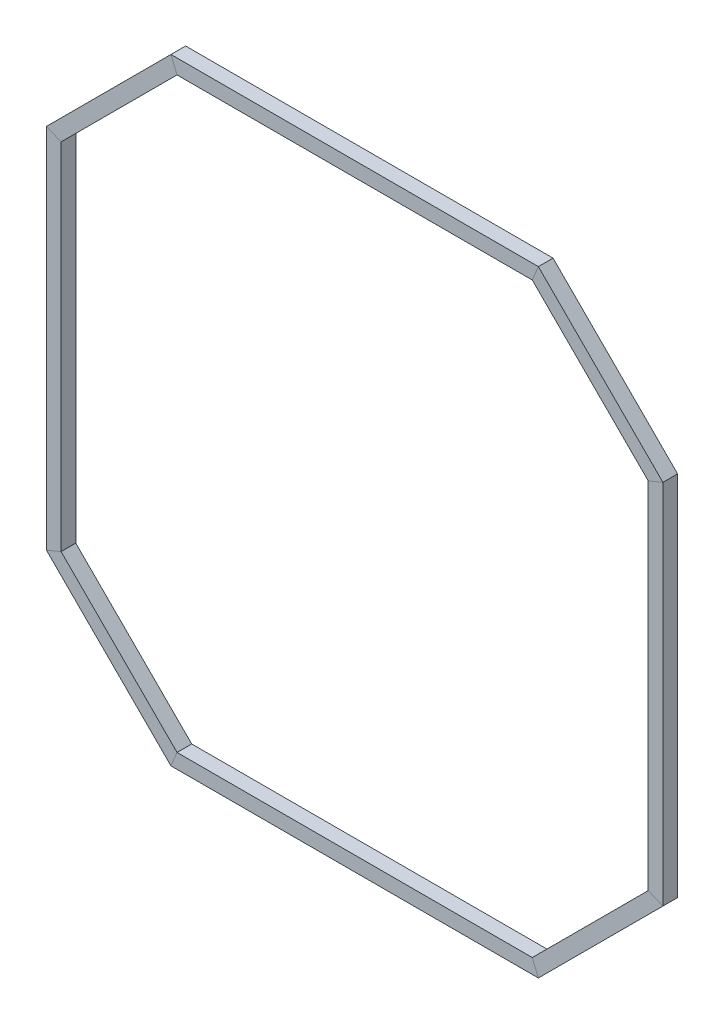
from build123d import *

# Parameters (mm, degrees)
MEMBER_1_DEPTH            = 257.152236891
MEMBER_1_DEPTH_BACK       = 6.857864376
SKETCH11_W                = 10
SKETCH11_H                = 10
SKETCH11_W_2              = 8
SKETCH11_H_2              = 8
SKETCH11_ON_SEGMENT_2_W   = 10
SKETCH11_ON_SEGMENT_2_H   = 10
SKETCH11_ON_SEGMENT_2_W_2 = 8
SKETCH11_ON_SEGMENT_2_H_2 = 8
MEMBER_1_2_DEPTH          = 133.715728753
SKETCH11_ON_SEGMENT_3_W   = 10
SKETCH11_ON_SEGMENT_3_H   = 10
SKETCH11_ON_SEGMENT_3_W_2 = 8
SKETCH11_ON_SEGMENT_3_H_2 = 8
MEMBER_1_3_DEPTH          = 263.715728753
SKETCH11_ON_SEGMENT_4_W   = 10
SKETCH11_ON_SEGMENT_4_H   = 10
SKETCH11_ON_SEGMENT_4_W_2 = 8
SKETCH11_ON_SEGMENT_4_H_2 = 8
MEMBER_1_4_DEPTH          = 133.715728753
SKETCH11_ON_SEGMENT_5_W   = 10
SKETCH11_ON_SEGMENT_5_H   = 10
SKETCH11_ON_SEGMENT_5_W_2 = 8
SKETCH11_ON_SEGMENT_5_H_2 = 8
MEMBER_1_5_DEPTH          = 264.010101268
SKETCH11_ON_SEGMENT_6_W   = 10
SKETCH11_ON_SEGMENT_6_H   = 10
SKETCH11_ON_SEGMENT_6_W_2 = 8
SKETCH11_ON_SEGMENT_6_H_2 = 8
MEMBER_1_6_DEPTH          = 133.715728753
SKETCH11_ON_SEGMENT_7_W   = 10
SKETCH11_ON_SEGMENT_7_H   = 10
SKETCH11_ON_SEGMENT_7_W_2 = 8
SKETCH11_ON_SEGMENT_7_H_2 = 8
MEMBER_1_7_DEPTH          = 263.715728753
SKETCH11_ON_SEGMENT_8_W   = 10
SKETCH11_ON_SEGMENT_8_H   = 10
SKETCH11_ON_SEGMENT_8_W_2 = 8
SKETCH11_ON_SEGMENT_8_H_2 = 8
MEMBER_1_8_DEPTH          = 133.715728753


with BuildPart() as part:
    # Sketch11 → Member 1 (new, two sides: drawn at the far end of the back side and taken through both)
    with BuildSketch(Plane(origin=(-125.147186258, -204.852813742, -5), x_dir=(0, 1, 0), z_dir=(1, 0, 0)).offset(-MEMBER_1_DEPTH_BACK)):
        Rectangle(SKETCH11_W, SKETCH11_H)
        Rectangle(SKETCH11_W_2, SKETCH11_H_2, mode=Mode.SUBTRACT)
    extrude(amount=MEMBER_1_DEPTH + MEMBER_1_DEPTH_BACK)

    # Member 1 mitre 1
    split(bisect_by=Plane(origin=(-125.147186258, -209.852813742, 0), x_dir=(0.382683432, 0.923879533, 0), z_dir=(0.923879533, -0.382683432, 0)), keep=Keep.TOP)

    # Member 1 mitre 2
    split(bisect_by=Plane(origin=(125.147186258, -209.852813742, 0), x_dir=(0.382683432, -0.923879533, 0), z_dir=(-0.923879533, -0.382683432, 0)), keep=Keep.TOP)


with BuildPart() as body_2:
    # Sketch11 on segment 2 (carried to segment 2) → Member 1 2 (new body)
    with BuildSketch(Plane(origin=(116.762409947, -211.166522241, -5), x_dir=(-0.707106781, 0.707106781, 0), z_dir=(0.707106781, 0.707106781, 0))):
        Rectangle(SKETCH11_ON_SEGMENT_2_W, SKETCH11_ON_SEGMENT_2_H)
        Rectangle(SKETCH11_ON_SEGMENT_2_W_2, SKETCH11_ON_SEGMENT_2_H_2, mode=Mode.SUBTRACT)
    extrude(amount=MEMBER_1_2_DEPTH)

    # Member 1 2 mitre 1
    split(bisect_by=Plane(origin=(125.147186258, -209.852813742, 0), x_dir=(-0.382683432, 0.923879533, 0), z_dir=(0.923879533, 0.382683432, 0)), keep=Keep.TOP)

    # Member 1 2 mitre 2
    split(bisect_by=Plane(origin=(210, -125, 0), x_dir=(0.923879533, -0.382683432, 0), z_dir=(-0.382683432, -0.923879533, 0)), keep=Keep.TOP)


with BuildPart() as body_3:
    # Sketch11 on segment 3 (carried to segment 3) → Member 1 3 (new body)
    with BuildSketch(Plane(origin=(205, -131.857864376, -5), x_dir=(-1, 0, 0), z_dir=(0, 1, 0))):
        Rectangle(SKETCH11_ON_SEGMENT_3_W, SKETCH11_ON_SEGMENT_3_H)
        Rectangle(SKETCH11_ON_SEGMENT_3_W_2, SKETCH11_ON_SEGMENT_3_H_2, mode=Mode.SUBTRACT)
    extrude(amount=MEMBER_1_3_DEPTH)

    # Member 1 3 mitre 1
    split(bisect_by=Plane(origin=(210, -125, 0), x_dir=(-0.923879533, 0.382683432, 0), z_dir=(0.382683432, 0.923879533, 0)), keep=Keep.TOP)

    # Member 1 3 mitre 2
    split(bisect_by=Plane(origin=(210, 125, 0), x_dir=(0.923879533, 0.382683432, 0), z_dir=(0.382683432, -0.923879533, 0)), keep=Keep.TOP)


with BuildPart() as body_4:
    # Sketch11 on segment 4 (carried to segment 4) → Member 1 4 (new body)
    with BuildSketch(Plane(origin=(211.313708499, 116.615223689, -5), x_dir=(-0.707106781, -0.707106781, 0), z_dir=(-0.707106781, 0.707106781, 0))):
        Rectangle(SKETCH11_ON_SEGMENT_4_W, SKETCH11_ON_SEGMENT_4_H)
        Rectangle(SKETCH11_ON_SEGMENT_4_W_2, SKETCH11_ON_SEGMENT_4_H_2, mode=Mode.SUBTRACT)
    extrude(amount=MEMBER_1_4_DEPTH)

    # Member 1 4 mitre 1
    split(bisect_by=Plane(origin=(210, 125, 0), x_dir=(-0.923879533, -0.382683432, 0), z_dir=(-0.382683432, 0.923879533, 0)), keep=Keep.TOP)

    # Member 1 4 mitre 2
    split(bisect_by=Plane(origin=(125.147186258, 209.852813742, 0), x_dir=(0.382683432, 0.923879533, 0), z_dir=(0.923879533, -0.382683432, 0)), keep=Keep.TOP)


with BuildPart() as body_5:
    # Sketch11 on segment 5 (carried to segment 5) → Member 1 5 (new body)
    with BuildSketch(Plane(origin=(132.005050634, 204.852813742, -5), x_dir=(0, -1, 0), z_dir=(-1, 0, 0))):
        Rectangle(SKETCH11_ON_SEGMENT_5_W, SKETCH11_ON_SEGMENT_5_H)
        Rectangle(SKETCH11_ON_SEGMENT_5_W_2, SKETCH11_ON_SEGMENT_5_H_2, mode=Mode.SUBTRACT)
    extrude(amount=MEMBER_1_5_DEPTH)

    # Member 1 5 mitre 1
    split(bisect_by=Plane(origin=(-125.147186258, 209.852813742, 0), x_dir=(-0.382683432, 0.923879533, 0), z_dir=(0.923879533, 0.382683432, 0)), keep=Keep.TOP)

    # Member 1 5 mitre 2
    split(bisect_by=Plane(origin=(125.147186258, 209.852813742, 0), x_dir=(-0.382683432, -0.923879533, 0), z_dir=(-0.923879533, 0.382683432, 0)), keep=Keep.TOP)


with BuildPart() as body_6:
    # Sketch11 on segment 6 (carried to segment 6) → Member 1 6 (new body)
    with BuildSketch(Plane(origin=(-116.762409947, 211.166522241, -5), x_dir=(0.707106781, -0.707106781, 0), z_dir=(-0.707106781, -0.707106781, 0))):
        Rectangle(SKETCH11_ON_SEGMENT_6_W, SKETCH11_ON_SEGMENT_6_H)
        Rectangle(SKETCH11_ON_SEGMENT_6_W_2, SKETCH11_ON_SEGMENT_6_H_2, mode=Mode.SUBTRACT)
    extrude(amount=MEMBER_1_6_DEPTH)

    # Member 1 6 mitre 1
    split(bisect_by=Plane(origin=(-210, 125, 0), x_dir=(-0.923879533, 0.382683432, 0), z_dir=(0.382683432, 0.923879533, 0)), keep=Keep.TOP)

    # Member 1 6 mitre 2
    split(bisect_by=Plane(origin=(-125.147186258, 209.852813742, 0), x_dir=(0.382683432, -0.923879533, 0), z_dir=(-0.923879533, -0.382683432, 0)), keep=Keep.TOP)


with BuildPart() as body_7:
    # Sketch11 on segment 7 (carried to segment 7) → Member 1 7 (new body)
    with BuildSketch(Plane(origin=(-205, 131.857864376, -5), x_dir=(1, 0, 0), z_dir=(0, -1, 0))):
        Rectangle(SKETCH11_ON_SEGMENT_7_W, SKETCH11_ON_SEGMENT_7_H)
        Rectangle(SKETCH11_ON_SEGMENT_7_W_2, SKETCH11_ON_SEGMENT_7_H_2, mode=Mode.SUBTRACT)
    extrude(amount=MEMBER_1_7_DEPTH)

    # Member 1 7 mitre 1
    split(bisect_by=Plane(origin=(-210, -125, 0), x_dir=(-0.923879533, -0.382683432, 0), z_dir=(-0.382683432, 0.923879533, 0)), keep=Keep.TOP)

    # Member 1 7 mitre 2
    split(bisect_by=Plane(origin=(-210, 125, 0), x_dir=(0.923879533, -0.382683432, 0), z_dir=(-0.382683432, -0.923879533, 0)), keep=Keep.TOP)


with BuildPart() as body_8:
    # Sketch11 on segment 8 (carried to segment 8) → Member 1 8 (new body)
    with BuildSketch(Plane(origin=(-211.313708499, -116.615223689, -5), x_dir=(0.707106781, 0.707106781, 0), z_dir=(0.707106781, -0.707106781, 0))):
        Rectangle(SKETCH11_ON_SEGMENT_8_W, SKETCH11_ON_SEGMENT_8_H)
        Rectangle(SKETCH11_ON_SEGMENT_8_W_2, SKETCH11_ON_SEGMENT_8_H_2, mode=Mode.SUBTRACT)
    extrude(amount=MEMBER_1_8_DEPTH)

    # Member 1 8 mitre 1
    split(bisect_by=Plane(origin=(-125.147186258, -209.852813742, 0), x_dir=(-0.382683432, -0.923879533, 0), z_dir=(-0.923879533, 0.382683432, 0)), keep=Keep.TOP)

    # Member 1 8 mitre 2
    split(bisect_by=Plane(origin=(-210, -125, 0), x_dir=(0.923879533, 0.382683432, 0), z_dir=(0.382683432, -0.923879533, 0)), keep=Keep.TOP)


solid = Compound([part.part, body_2.part, body_3.part, body_4.part, body_5.part, body_6.part, body_7.part, body_8.part])
